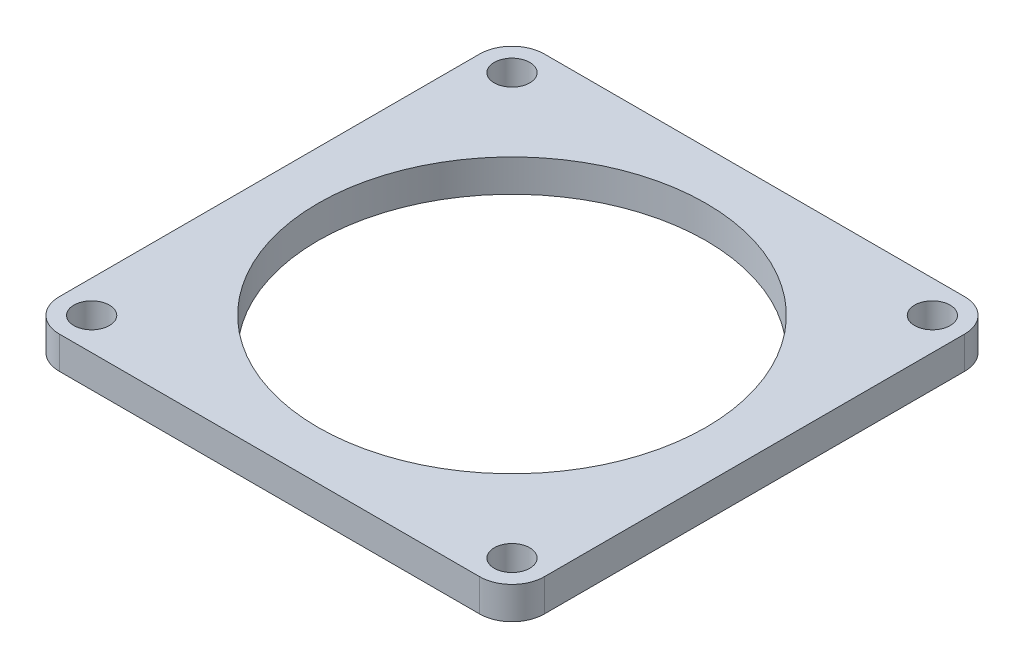
from build123d import *

# Parameters (mm, degrees)
SKETCH1_W           = 76.2
SKETCH1_H           = 76.2
SKETCH1_R           = 2.794
SKETCH1_R_2         = 30.48
BOSS_EXTRUDE1_DEPTH = 5.08
FILLET1_R           = 5.08


with BuildPart() as part:
    # Sketch1 → Boss-Extrude1 (new body)
    with BuildSketch(Plane(origin=(0, 0, 0), x_dir=(1, 0, 0), z_dir=(0, 1, 0))):
        Rectangle(SKETCH1_W, SKETCH1_H)
        with Locations(Location((33.02, 33.02, 0), (0, 0, 270))):
            Circle(SKETCH1_R, mode=Mode.SUBTRACT)
        with Locations(Location((33.02, -33.02, 0), (0, 0, 270))):
            Circle(SKETCH1_R, mode=Mode.SUBTRACT)
        with Locations(Location((-33.02, -33.02, 0), (0, 0, 270))):
            Circle(SKETCH1_R, mode=Mode.SUBTRACT)
        with Locations(Location((-33.02, 33.02, 0), (0, 0, 270))):
            Circle(SKETCH1_R, mode=Mode.SUBTRACT)
        with Locations(Location((0, 0, 0), (0, 0, 270))):
            Circle(SKETCH1_R_2, mode=Mode.SUBTRACT)
    extrude(amount=BOSS_EXTRUDE1_DEPTH)

    # Fillet1
    fillet1_edges = [part.edges().sort_by_distance(p)[0] for p in [
        (38.1, 2.54, 38.1),
        (-38.1, 2.54, 38.1),
        (-38.1, 2.54, -38.1),
        (38.1, 2.54, -38.1),
    ]]
    fillet(fillet1_edges, radius=FILLET1_R)


solid = part.part
